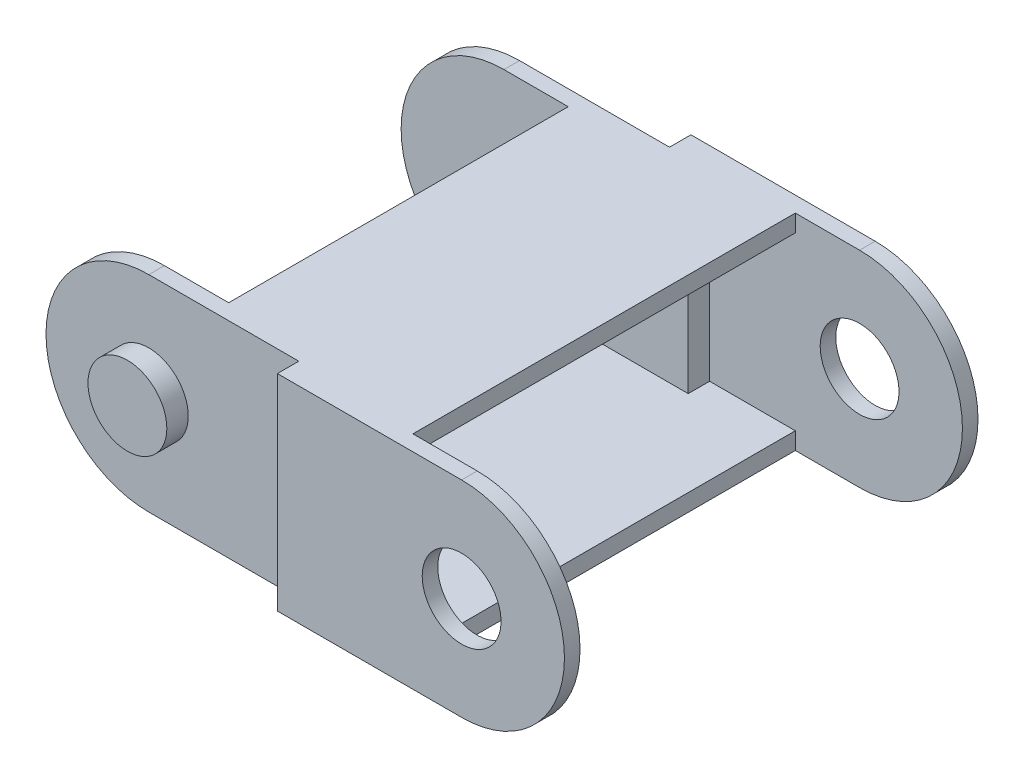
from build123d import *

# Parameters (mm, degrees)
SKETCH1_R           = 2.2999954
BOSS_EXTRUDE1_DEPTH = 12.065
SKETCH2_W           = 9.75
SKETCH2_H           = 22.312
SKETCH2_W_2         = 14.75
SKETCH2_H_2         = 1.25
SKETCH2_H_3         = 19.812
CUT_EXTRUDE1_DEPTH  = 31.656389628
SKETCH3_R           = 2.2999954
BOSS_EXTRUDE2_DEPTH = 1.25
BOSS_EXTRUDE3_START = 1.25
SKETCH4_R           = 2.2999954
BOSS_EXTRUDE3_DEPTH = 1.25
SKETCH5_W           = 19.812
SKETCH5_H           = 10
CUT_EXTRUDE2_DEPTH  = 26.585674214
SKETCH6_W           = 1.25
SKETCH6_H           = 10
CUT_EXTRUDE3_DEPTH  = 5


with BuildPart() as part:
    # Sketch1 → Boss-Extrude1 (new, symmetric)
    with BuildSketch(Plane(origin=(0, 0, 0), x_dir=(0, 1, 0), z_dir=(0, 0, 1))):
        with BuildLine():
            Line((-6, 0), (-6, 19.5))
            ThreePointArc((-6, 19.5), (0, 25.5), (6, 19.5))
            Line((6, 19.5), (6, 0))
            ThreePointArc((6, 0), (0, -6), (-6, 0))
        make_face()
        with Locations(Location((0, 0, 0), (0, 0, 90))):
            Circle(SKETCH1_R, mode=Mode.SUBTRACT)
    extrude(amount=BOSS_EXTRUDE1_DEPTH, both=True)

    # Sketch2 → Cut-Extrude1 (cut, through all)
    with BuildSketch(Plane.XZ.offset(6)):
        with Locations((1.125, 0)):
            Rectangle(SKETCH2_W, SKETCH2_H)
        with Locations((-18.125, 11.44)):
            Rectangle(SKETCH2_W_2, SKETCH2_H_2)
        with Locations((-18.125, -11.44)):
            Rectangle(SKETCH2_W_2, SKETCH2_H_2)
        with Locations((-20.625, 0)):
            Rectangle(SKETCH2_W, SKETCH2_H_3)
    extrude(amount=-CUT_EXTRUDE1_DEPTH, mode=Mode.SUBTRACT)

    # Sketch3 → Boss-Extrude2 (add)
    with BuildSketch(Plane.XY.offset(10.815)):
        with Locations(Location((-19.5, 0, 0), (0, 0, 180))):
            Circle(SKETCH3_R)
    extrude(amount=BOSS_EXTRUDE2_DEPTH)

    # Sketch4 → Boss-Extrude3 (add)
    with BuildSketch(Plane(origin=(0, 0, -10.815), x_dir=(1, 0, 0), z_dir=(0, 0, -1)).offset(BOSS_EXTRUDE3_START)):
        with Locations(Location((-19.5, 0, 0), (0, 0, 180))):
            Circle(SKETCH4_R)
    extrude(amount=-BOSS_EXTRUDE3_DEPTH)

    # Sketch5 → Cut-Extrude2 (cut, through all)
    with BuildSketch(Plane(origin=(-3.75, 0, 0), x_dir=(0, 0, -1), z_dir=(1, 0, 0))):
        Rectangle(SKETCH5_W, SKETCH5_H)
    extrude(amount=-CUT_EXTRUDE2_DEPTH, mode=Mode.SUBTRACT)

    # Sketch6 → Cut-Extrude3 (cut)
    with BuildSketch(Plane(origin=(-3.75, 0, 0), x_dir=(0, 0, -1), z_dir=(1, 0, 0))):
        with Locations((-10.531, 0)):
            Rectangle(SKETCH6_W, SKETCH6_H)
        with Locations((10.531, 0)):
            Rectangle(SKETCH6_W, SKETCH6_H)
    extrude(amount=-CUT_EXTRUDE3_DEPTH, mode=Mode.SUBTRACT)


solid = part.part
